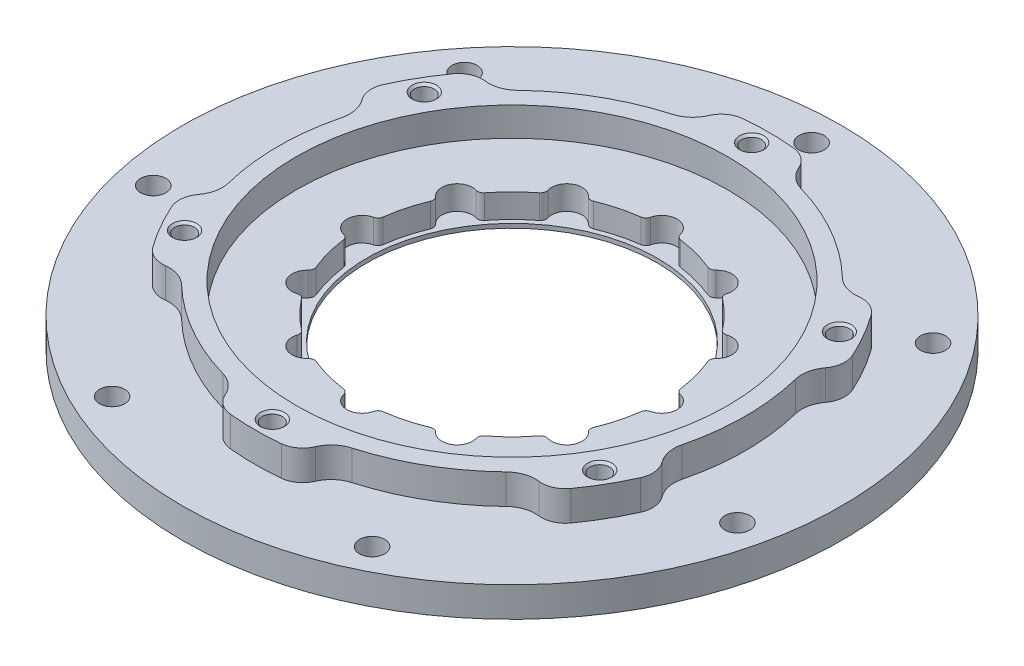
from build123d import *

# Parameters (mm, degrees)
SKETCH_1_R                  = 42.95
SKETCH_1_R_2                = 13.5
EXTRUDE_1_DEPTH             = 10
SKETCH_2_R                  = 24.25
CUT_EXTRUDE_1_DEPTH         = 62.558143247
SKETCH_9_R                  = 36
CUT_EXTRUDE_4_DEPTH         = 4.8
SKETCH_10_R                 = 2.55
CUT_EXTRUDE_5_DEPTH         = 4
SKETCH_11_R                 = 25.05
CUT_EXTRUDE_6_DEPTH         = 4
FILLET_3_R                  = 1
HOLE_WIZARD_M4_1_AT_2_COUNT = 2
HOLE_WIZARD_M4_1_AT_2_PITCH = 40
HOLE_WIZARD_M4_1_AT_3_COUNT = 2
HOLE_WIZARD_M4_1_AT_3_PITCH = 69.282032303
HOLE_WIZARD_M4_1_AT_4_COUNT = 2
HOLE_WIZARD_M4_1_AT_4_PITCH = 80
HOLE_WIZARD_M4_1_AT_5_COUNT = 2
HOLE_WIZARD_M4_1_AT_5_PITCH = 69.282032303
HOLE_WIZARD_M4_1_AT_6_COUNT = 2
HOLE_WIZARD_M4_1_AT_6_PITCH = 40
SKETCH_25_R                 = 25.25
CUT_EXTRUDE_13_DEPTH        = 0.5
CUT_EXTRUDE_14_DEPTH        = 62.558143247
FILLET_4_R                  = 4
CUT_EXTRUDE_16_DEPTH        = 3.5
EXTRUDE_START               = -5
SKETCH_30_R                 = 55
SKETCH_30_R_2               = 2.1
EXTRUDE_2_DEPTH             = 5


with BuildPart() as part:
    # 草图1 → 凸台-拉伸1 (new body)
    with BuildSketch(Plane(origin=(0, 0, 0), x_dir=(1, 0, 0), z_dir=(0, 1, 0))):
        with Locations(Location((0, 0, 0), (0, 0, 270))):
            Circle(SKETCH_1_R)
        with Locations(Location((0, 0, 0), (0, 0, 270))):
            Circle(SKETCH_1_R_2, mode=Mode.SUBTRACT)
    extrude(amount=EXTRUDE_1_DEPTH)

    # 草图2 → 切除-拉伸1 (cut, through all)
    with BuildSketch(Plane(origin=(0, 10, 0), x_dir=(1, 0, 0), z_dir=(0, 1, 0))):
        with Locations(Location((0, 0, 0), (0, 0, 270))):
            Circle(SKETCH_2_R)
    extrude(amount=-CUT_EXTRUDE_1_DEPTH, mode=Mode.SUBTRACT)

    # 草图9 → 切除-拉伸4 (cut)
    with BuildSketch(Plane(origin=(0, 10, 0), x_dir=(1, 0, 0), z_dir=(0, 1, 0))):
        with Locations(Location((0, 0, 0), (0, 0, 270))):
            Circle(SKETCH_9_R)
    extrude(amount=-CUT_EXTRUDE_4_DEPTH, mode=Mode.SUBTRACT)

    # 草图10 → 切除-拉伸5 (cut)
    with BuildSketch(Plane(origin=(0, 5.2, 0), x_dir=(1, 0, 0), z_dir=(0, 1, 0))):
        with Locations((0, 25)):
            Circle(SKETCH_10_R)
        with Locations((12.5, 21.650635095)):
            Circle(SKETCH_10_R)
        with Locations((21.650635095, 12.5)):
            Circle(SKETCH_10_R)
        with Locations((25, 0)):
            Circle(SKETCH_10_R)
        with Locations((21.650635095, -12.5)):
            Circle(SKETCH_10_R)
        with Locations((12.5, -21.650635095)):
            Circle(SKETCH_10_R)
        with Locations((0, -25)):
            Circle(SKETCH_10_R)
        with Locations((-12.5, -21.650635095)):
            Circle(SKETCH_10_R)
        with Locations((-21.650635095, -12.5)):
            Circle(SKETCH_10_R)
        with Locations((-25, 0)):
            Circle(SKETCH_10_R)
        with Locations((-21.650635095, 12.5)):
            Circle(SKETCH_10_R)
        with Locations((-12.5, 21.650635095)):
            Circle(SKETCH_10_R)
    extrude(amount=-CUT_EXTRUDE_5_DEPTH, mode=Mode.SUBTRACT)

    # 草图11 → 切除-拉伸6 (cut)
    with BuildSketch(Plane(origin=(0, 5.2, 0), x_dir=(1, 0, 0), z_dir=(0, 1, 0))):
        Circle(SKETCH_11_R)
    extrude(amount=-CUT_EXTRUDE_6_DEPTH, mode=Mode.SUBTRACT)

    # 圆角3
    fillet_3_edges = [part.edges().sort_by_distance(p)[0] for p in [
        (-20.306980668, 3.2, 14.667277735),
        (-22.855725457, 3.2, 10.252722265),
        (2.548744789, 3.2, -24.92),
        (10.252722265, 3.2, -22.855725457),
        (-2.548744789, 3.2, -24.92),
        (-10.252722265, 3.2, -22.855725457),
        (-14.667277735, 3.2, -20.306980668),
        (-20.306980668, 3.2, -14.667277735),
        (-22.855725457, 3.2, -10.252722265),
        (-24.92, 3.2, -2.548744789),
        (-24.92, 3.2, 2.548744789),
        (14.667277735, 3.2, -20.306980668),
        (20.306980668, 3.2, -14.667277735),
        (22.855725457, 3.2, -10.252722265),
        (24.92, 3.2, -2.548744789),
        (24.92, 3.2, 2.548744789),
        (22.855725457, 3.2, 10.252722265),
        (20.306980668, 3.2, 14.667277735),
        (14.667277735, 3.2, 20.306980668),
        (10.252722265, 3.2, 22.855725457),
        (2.548744789, 3.2, 24.92),
        (-2.548744789, 3.2, 24.92),
        (-10.252722265, 3.2, 22.855725457),
        (-14.667277735, 3.2, 20.306980668),
    ]]
    fillet(fillet_3_edges, radius=FILLET_3_R)

    # 草图19 → M4 螺纹孔1 (revolve, cut)
    with BuildSketch(Plane(origin=(0, 0, 40), x_dir=(0, 0, -1), z_dir=(1, 0, 0))):
        Polygon((0, 0), (0, 10), (2.025, 10), (1.65, 9.625), (1.65, 0.375), (2.025, 0), align=None)
    hole_wizard_m4_1 = revolve(axis=Axis((0, -6.35, 40), (0, 1, 0)), mode=Mode.SUBTRACT)

    # M4 螺纹孔1 at 2: M4 螺纹孔1 ×2
    with Locations(*[Vector(-0.8660254037844367, 0, -0.5000000000000036) * (i * HOLE_WIZARD_M4_1_AT_2_PITCH) for i in range(1, HOLE_WIZARD_M4_1_AT_2_COUNT)]):
        add(hole_wizard_m4_1, mode=Mode.SUBTRACT)

    # M4 螺纹孔1 at 3: M4 螺纹孔1 ×2
    with Locations(*[Vector(-0.4999999999999965, 0, -0.8660254037844407) * (i * HOLE_WIZARD_M4_1_AT_3_PITCH) for i in range(1, HOLE_WIZARD_M4_1_AT_3_COUNT)]):
        add(hole_wizard_m4_1, mode=Mode.SUBTRACT)

    # M4 螺纹孔1 at 4: M4 螺纹孔1 ×2
    with Locations(*[(0, 0, -i * HOLE_WIZARD_M4_1_AT_4_PITCH) for i in range(1, HOLE_WIZARD_M4_1_AT_4_COUNT)]):
        add(hole_wizard_m4_1, mode=Mode.SUBTRACT)

    # M4 螺纹孔1 at 5: M4 螺纹孔1 ×2
    with Locations(*[Vector(0.5000000000000036, 0, -0.8660254037844367) * (i * HOLE_WIZARD_M4_1_AT_5_PITCH) for i in range(1, HOLE_WIZARD_M4_1_AT_5_COUNT)]):
        add(hole_wizard_m4_1, mode=Mode.SUBTRACT)

    # M4 螺纹孔1 at 6: M4 螺纹孔1 ×2
    with Locations(*[Vector(0.8660254037844406, 0, -0.49999999999999667) * (i * HOLE_WIZARD_M4_1_AT_6_PITCH) for i in range(1, HOLE_WIZARD_M4_1_AT_6_COUNT)]):
        add(hole_wizard_m4_1, mode=Mode.SUBTRACT)

    # 草图25 → 切除-拉伸13 (cut)
    with BuildSketch(Plane.XZ):
        with Locations(Location((0, 0, 0), (0, 0, 270))):
            Circle(SKETCH_25_R)
    extrude(amount=-CUT_EXTRUDE_13_DEPTH, mode=Mode.SUBTRACT)

    # 草图26 → 切除-拉伸14 (cut, through all)
    with BuildSketch(Plane(origin=(0, 10, 0), x_dir=(1, 0, 0), z_dir=(0, 1, 0))):
        with BuildLine():
            ThreePointArc((-37.841533325, 9.434953928), (-38.102056345, 12.625251816), (-40.244113264, 15.003794439))
            ThreePointArc((-40.244113264, 15.003794439), (-42.95, 0), (-40.244113264, -15.003794439))
            ThreePointArc((-40.244113264, -15.003794439), (-38.102056345, -12.625251816), (-37.841533325, -9.434953928))
            ThreePointArc((-37.841533325, -9.434953928), (-39, 0), (-37.841533325, 9.434953928))
        make_face()
        with BuildLine():
            ThreePointArc((-10.749856877, 37.489206142), (-8.117239371, 39.309974639), (-7.128389495, 42.354321659))
            ThreePointArc((-7.128389495, 42.354321659), (-21.475, 37.195791093), (-33.11572377, 27.35052722))
            ThreePointArc((-33.11572377, 27.35052722), (-29.984816974, 26.684722823), (-27.091676448, 28.054252213))
            ThreePointArc((-27.091676448, 28.054252213), (-19.5, 33.774990748), (-10.749856877, 37.489206142))
        make_face()
        with BuildLine():
            ThreePointArc((33.11572377, 27.35052722), (21.475, 37.195791093), (7.128389495, 42.354321659))
            ThreePointArc((7.128389495, 42.354321659), (8.117239371, 39.309974639), (10.749856877, 37.489206142))
            ThreePointArc((10.749856877, 37.489206142), (19.5, 33.774990748), (27.091676448, 28.054252213))
            ThreePointArc((27.091676448, 28.054252213), (29.984816974, 26.684722823), (33.11572377, 27.35052722))
        make_face()
        with BuildLine():
            ThreePointArc((42.95, 0), (42.268115434, 7.622920546), (40.244113264, 15.003794439))
            ThreePointArc((40.244113264, 15.003794439), (38.102056345, 12.625251816), (37.841533325, 9.434953928))
            ThreePointArc((37.841533325, 9.434953928), (39, 0), (37.841533325, -9.434953928))
            ThreePointArc((37.841533325, -9.434953928), (38.102056345, -12.625251816), (40.244113264, -15.003794439))
            ThreePointArc((40.244113264, -15.003794439), (42.268115434, -7.622920546), (42.95, 0))
        make_face()
        with BuildLine():
            ThreePointArc((10.749856877, -37.489206142), (8.117239371, -39.309974639), (7.128389495, -42.354321659))
            ThreePointArc((7.128389495, -42.354321659), (21.475, -37.195791093), (33.11572377, -27.35052722))
            ThreePointArc((33.11572377, -27.35052722), (29.984816974, -26.684722823), (27.091676448, -28.054252213))
            ThreePointArc((27.091676448, -28.054252213), (19.5, -33.774990748), (10.749856877, -37.489206142))
        make_face()
        with BuildLine():
            ThreePointArc((-27.091676448, -28.054252213), (-29.984816974, -26.684722823), (-33.11572377, -27.35052722))
            ThreePointArc((-33.11572377, -27.35052722), (-21.475, -37.195791093), (-7.128389495, -42.354321659))
            ThreePointArc((-7.128389495, -42.354321659), (-8.117239371, -39.309974639), (-10.749856877, -37.489206142))
            ThreePointArc((-10.749856877, -37.489206142), (-19.5, -33.774990748), (-27.091676448, -28.054252213))
        make_face()
    extrude(amount=-CUT_EXTRUDE_14_DEPTH, mode=Mode.SUBTRACT)

    # 圆角4
    fillet_4_edges = [part.edges().sort_by_distance(p)[0] for p in [
        (-40.244113264, 5, 15.003794439),
        (-40.244113264, 5, -15.003794439),
        (-7.128389495, 5, 42.354321659),
        (-33.11572377, 5, 27.35052722),
        (33.11572377, 5, 27.35052722),
        (7.128389495, 5, 42.354321659),
        (40.244113264, 5, -15.003794439),
        (40.244113264, 5, 15.003794439),
        (7.128389495, 5, -42.354321659),
        (33.11572377, 5, -27.35052722),
        (-33.11572377, 5, -27.35052722),
        (-7.128389495, 5, -42.354321659),
    ]]
    fillet(fillet_4_edges, radius=FILLET_4_R)

    # 草图27 → 切除-拉伸16 (cut)
    with BuildSketch(Plane.XZ):
        with BuildLine():
            ThreePointArc((-9.135536526, 35.648029011), (-18.4, 31.869734859), (-26.304330456, 25.735621214))
            ThreePointArc((-26.304330456, 25.735621214), (-26.245605045, 20.361930552), (-20.871914383, 20.420655963))
            ThreePointArc((-20.871914383, 20.420655963), (-14.6, 25.287941791), (-7.248849634, 28.285936063))
            ThreePointArc((-7.248849634, 28.285936063), (-4.511146606, 32.910325983), (-9.135536526, 35.648029011))
        make_face()
        with BuildLine():
            ThreePointArc((26.304330456, 25.735621214), (18.4, 31.869734859), (9.135536526, 35.648029011))
            ThreePointArc((9.135536526, 35.648029011), (4.511146606, 32.910325983), (7.248849634, 28.285936063))
            ThreePointArc((7.248849634, 28.285936063), (14.6, 25.287941791), (20.871914383, 20.420655963))
            ThreePointArc((20.871914383, 20.420655963), (26.245605045, 20.361930552), (26.304330456, 25.735621214))
        make_face()
        with BuildLine():
            ThreePointArc((35.439866981, -9.912407797), (36.8, 0), (35.439866981, 9.912407797))
            ThreePointArc((35.439866981, 9.912407797), (30.756751651, 12.54839543), (28.120764018, 7.8652801))
            ThreePointArc((28.120764018, 7.8652801), (29.2, 0), (28.120764018, -7.8652801))
            ThreePointArc((28.120764018, -7.8652801), (30.756751651, -12.54839543), (35.439866981, -9.912407797))
        make_face()
        with BuildLine():
            ThreePointArc((9.135536526, -35.648029011), (18.4, -31.869734859), (26.304330456, -25.735621214))
            ThreePointArc((26.304330456, -25.735621214), (26.245605045, -20.361930552), (20.871914383, -20.420655963))
            ThreePointArc((20.871914383, -20.420655963), (14.6, -25.287941791), (7.248849634, -28.285936063))
            ThreePointArc((7.248849634, -28.285936063), (4.511146606, -32.910325983), (9.135536526, -35.648029011))
        make_face()
        with BuildLine():
            ThreePointArc((-26.304330456, -25.735621214), (-18.4, -31.869734859), (-9.135536526, -35.648029011))
            ThreePointArc((-9.135536526, -35.648029011), (-4.511146606, -32.910325983), (-7.248849634, -28.285936063))
            ThreePointArc((-7.248849634, -28.285936063), (-14.6, -25.287941791), (-20.871914383, -20.420655963))
            ThreePointArc((-20.871914383, -20.420655963), (-26.245605045, -20.361930552), (-26.304330456, -25.735621214))
        make_face()
        with BuildLine():
            ThreePointArc((-35.439866981, 9.912407797), (-36.8, 0), (-35.439866981, -9.912407797))
            ThreePointArc((-35.439866981, -9.912407797), (-30.756751651, -12.54839543), (-28.120764018, -7.8652801))
            ThreePointArc((-28.120764018, -7.8652801), (-29.2, 0), (-28.120764018, 7.8652801))
            ThreePointArc((-28.120764018, 7.8652801), (-30.756751651, 12.54839543), (-35.439866981, 9.912407797))
        make_face()
    extrude(amount=-CUT_EXTRUDE_16_DEPTH, mode=Mode.SUBTRACT)

    # 草图30 → 凸台-拉伸2 (add)
    with BuildSketch(Plane.XZ.offset(EXTRUDE_START)):
        with Locations(Location((0, 0, 0), (0, 0, 270))):
            Circle(SKETCH_30_R)
        with Locations(Location((-21.69081728, 45.05006599, 0), (0, 0, 270))):
            Circle(SKETCH_30_R_2, mode=Mode.SUBTRACT)
        with Locations(Location((21.697556511, 45.046820548, 0), (0, 0, 270))):
            Circle(SKETCH_30_R_2, mode=Mode.SUBTRACT)
        with Locations(Location((48.747227699, 11.122400445, 0), (0, 0, 270))):
            Circle(SKETCH_30_R_2, mode=Mode.SUBTRACT)
        with Locations(Location((39.089242168, -31.177414049, 0), (0, 0, 270))):
            Circle(SKETCH_30_R_2, mode=Mode.SUBTRACT)
        with Locations(Location((-0.003739991, -49.99999986, 0), (0, 0, 270))):
            Circle(SKETCH_30_R_2, mode=Mode.SUBTRACT)
        with Locations(Location((-39.09390586, -31.171565963, 0), (0, 0, 270))):
            Circle(SKETCH_30_R_2, mode=Mode.SUBTRACT)
        with Locations(Location((-48.745563246, 11.129692889, 0), (0, 0, 270))):
            Circle(SKETCH_30_R_2, mode=Mode.SUBTRACT)
        with BuildLine():
            ThreePointArc((-39.137224272, -17.691245753), (-37.195791093, -21.475), (-34.889680383, -25.048207576))
            ThreePointArc((-34.889680383, -25.048207576), (-33.250121727, -26.377209714), (-31.162402816, -26.68677233))
            ThreePointArc((-31.162402816, -26.68677233), (-28.972756266, -26.911240165), (-27.091676448, -28.054252213))
            ThreePointArc((-27.091676448, -28.054252213), (-19.5, -33.774990748), (-10.749856877, -37.489206142))
            ThreePointArc((-10.749856877, -37.489206142), (-8.819439497, -38.546763026), (-7.530221375, -40.330818647))
            ThreePointArc((-7.530221375, -40.330818647), (-6.218272829, -41.984054951), (-4.247543889, -42.73945333))
            ThreePointArc((-4.247543889, -42.73945333), (0, -42.95), (4.247543889, -42.73945333))
            ThreePointArc((4.247543889, -42.73945333), (6.218272829, -41.984054951), (7.530221375, -40.330818647))
            ThreePointArc((7.530221375, -40.330818647), (8.819439497, -38.546763026), (10.749856877, -37.489206142))
            ThreePointArc((10.749856877, -37.489206142), (19.5, -33.774990748), (27.091676448, -28.054252213))
            ThreePointArc((27.091676448, -28.054252213), (28.972756266, -26.911240165), (31.162402816, -26.68677233))
            ThreePointArc((31.162402816, -26.68677233), (33.250121727, -26.377209714), (34.889680383, -25.048207576))
            ThreePointArc((34.889680383, -25.048207576), (37.195791093, -21.475), (39.137224272, -17.691245753))
            ThreePointArc((39.137224272, -17.691245753), (39.468394557, -15.606845238), (38.692624191, -13.644046316))
            ThreePointArc((38.692624191, -13.644046316), (37.792195763, -11.635522861), (37.841533325, -9.434953928))
            ThreePointArc((37.841533325, -9.434953928), (39, 0), (37.841533325, 9.434953928))
            ThreePointArc((37.841533325, 9.434953928), (37.792195763, 11.635522861), (38.692624191, 13.644046316))
            ThreePointArc((38.692624191, 13.644046316), (39.468394557, 15.606845238), (39.137224272, 17.691245753))
            ThreePointArc((39.137224272, 17.691245753), (37.195791093, 21.475), (34.889680383, 25.048207576))
            ThreePointArc((34.889680383, 25.048207576), (33.250121727, 26.377209714), (31.162402816, 26.68677233))
            ThreePointArc((31.162402816, 26.68677233), (28.972756266, 26.911240165), (27.091676448, 28.054252213))
            ThreePointArc((27.091676448, 28.054252213), (19.5, 33.774990748), (10.749856877, 37.489206142))
            ThreePointArc((10.749856877, 37.489206142), (8.819439497, 38.546763026), (7.530221375, 40.330818647))
            ThreePointArc((7.530221375, 40.330818647), (6.218272829, 41.984054951), (4.247543889, 42.73945333))
            ThreePointArc((4.247543889, 42.73945333), (0, 42.95), (-4.247543889, 42.73945333))
            ThreePointArc((-4.247543889, 42.73945333), (-6.218272829, 41.984054951), (-7.530221375, 40.330818647))
            ThreePointArc((-7.530221375, 40.330818647), (-8.819439497, 38.546763026), (-10.749856877, 37.489206142))
            ThreePointArc((-10.749856877, 37.489206142), (-19.5, 33.774990748), (-27.091676448, 28.054252213))
            ThreePointArc((-27.091676448, 28.054252213), (-28.972756266, 26.911240165), (-31.162402816, 26.68677233))
            ThreePointArc((-31.162402816, 26.68677233), (-33.250121727, 26.377209714), (-34.889680383, 25.048207576))
            ThreePointArc((-34.889680383, 25.048207576), (-37.195791093, 21.475), (-39.137224272, 17.691245753))
            ThreePointArc((-39.137224272, 17.691245753), (-39.468394557, 15.606845238), (-38.692624191, 13.644046316))
            ThreePointArc((-38.692624191, 13.644046316), (-37.792195763, 11.635522861), (-37.841533325, 9.434953928))
            ThreePointArc((-37.841533325, 9.434953928), (-39, 0), (-37.841533325, -9.434953928))
            ThreePointArc((-37.841533325, -9.434953928), (-37.792195763, -11.635522861), (-38.692624191, -13.644046316))
            ThreePointArc((-38.692624191, -13.644046316), (-39.468394557, -15.606845238), (-39.137224272, -17.691245753))
        make_face(mode=Mode.SUBTRACT)
    extrude(amount=EXTRUDE_2_DEPTH)


solid = part.part
